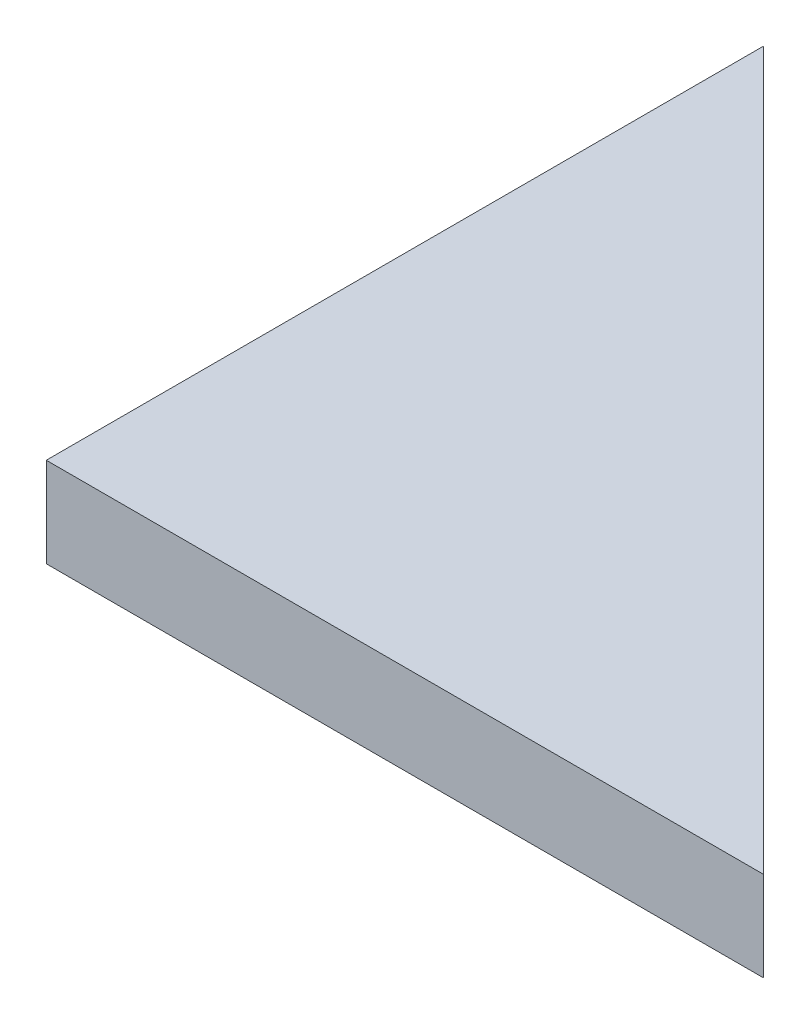
from build123d import *

# Parameters (mm, degrees)
BOSS_EXTRUDE1_DEPTH = 3.175


with BuildPart() as part:
    # Sketch1 → Boss-Extrude1 (new body)
    with BuildSketch(Plane(origin=(0, 0, 0), x_dir=(1, 0, 0), z_dir=(0, 1, 0))):
        Polygon((0, 0), (25.4, 0), (0, 25.4), align=None)
    extrude(amount=BOSS_EXTRUDE1_DEPTH)


solid = part.part
